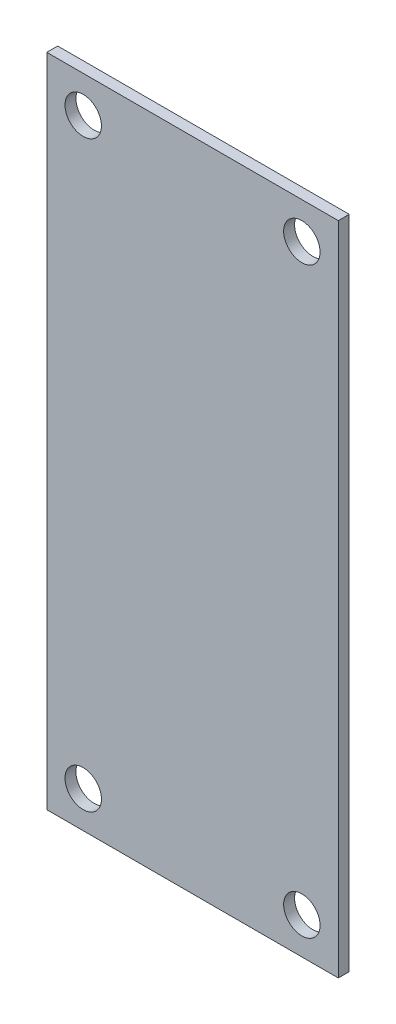
from build123d import *

# Parameters (mm, degrees)
SKETCH1_W           = 40
SKETCH1_H           = 41
BOSS_EXTRUDE1_DEPTH = 1.5
SKETCH2_R           = 2.5
CUT_EXTRUDE1_DEPTH  = 270.746640387


with BuildPart() as part:
    # Sketch1 → Boss-Extrude1 (new body)
    with BuildSketch(Plane.XY):
        Polygon((10, 269), (-10, 269), (-20, 269), (-20, 261), (-20, 220), (20, 220), (20, 261), (20, 269), align=None)
        with Locations((0, 199.5)):
            Rectangle(SKETCH1_W, SKETCH1_H)
    extrude(amount=BOSS_EXTRUDE1_DEPTH)

    # Sketch2 → Cut-Extrude1 (cut, through all)
    with BuildSketch(Plane.XY.offset(1.5)):
        with Locations((15, 264)):
            Circle(SKETCH2_R)
        with Locations(Location((15, 184, 0), (0, 0, 180))):
            Circle(SKETCH2_R)
        with Locations((-15, 184)):
            Circle(SKETCH2_R)
        with Locations(Location((-15, 264, 0), (0, 0, 180))):
            Circle(SKETCH2_R)
    extrude(amount=-CUT_EXTRUDE1_DEPTH, mode=Mode.SUBTRACT)


solid = part.part
